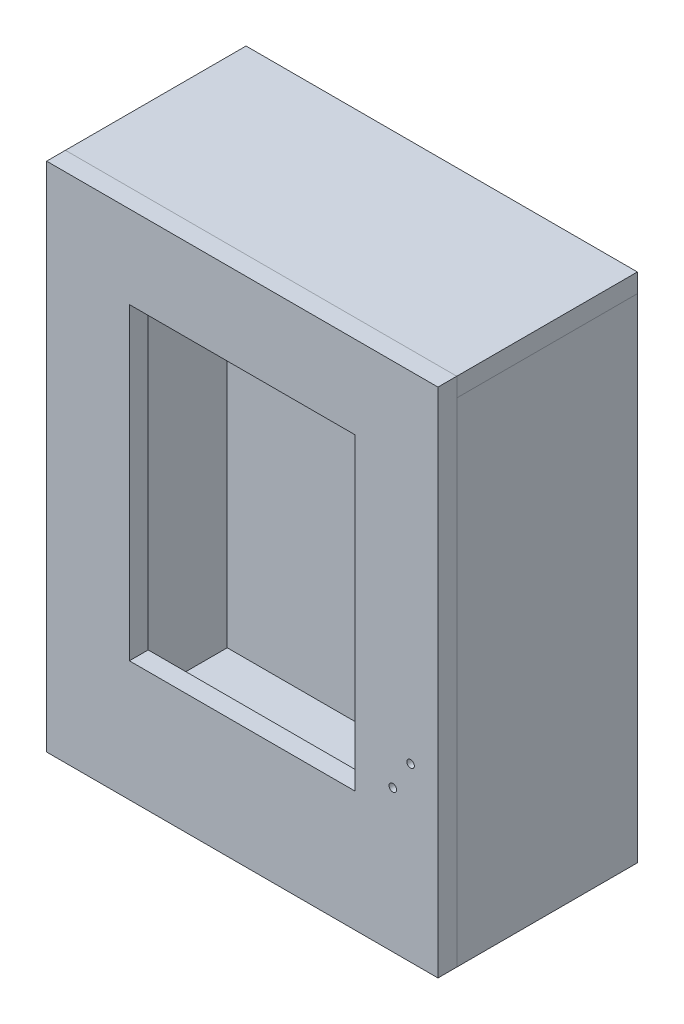
from build123d import *

# Parameters (mm, degrees)
SKETCH1_W           = 330.2
SKETCH1_H           = 431.8
SKETCH1_R           = 3.175
SKETCH1_W_2         = 190.5
SKETCH1_H_2         = 260.35
BOSS_EXTRUDE1_DEPTH = 7.9375
SKETCH3_W           = 152.4
SKETCH3_H           = 415.925
BOSS_EXTRUDE2_DEPTH = 15.875
BOSS_EXTRUDE6_START = -15.875
SKETCH8_W           = 298.45
SKETCH8_H           = 415.925
SKETCH8_R           = 9.6012
BOSS_EXTRUDE6_DEPTH = 15.875
SKETCH11_W          = 298.45
SKETCH11_H          = 120.65
BOSS_EXTRUDE7_DEPTH = 15.875
SKETCH14_W          = 330.2
SKETCH14_H          = 152.4
BOSS_EXTRUDE8_DEPTH = 15.875
BOSS_EXTRUDE5_DEPTH = 139.7


with BuildPart() as part:
    # Sketch1 → Boss-Extrude1 (new, symmetric)
    with BuildSketch(Plane.XY):
        with Locations((0, -15.875)):
            Rectangle(SKETCH1_W, SKETCH1_H)
        with Locations((127, -111.775)):
            Circle(SKETCH1_R, mode=Mode.SUBTRACT)
        with Locations((142, -86.775)):
            Circle(SKETCH1_R, mode=Mode.SUBTRACT)
        Rectangle(SKETCH1_W_2, SKETCH1_H_2, mode=Mode.SUBTRACT)
    extrude(amount=BOSS_EXTRUDE1_DEPTH, both=True)


with BuildPart() as body_2:
    # Sketch3 → Boss-Extrude2 (new body)
    with BuildSketch(Plane(origin=(165.1, 0, 0), x_dir=(0, 0, -1), z_dir=(1, 0, 0))):
        with Locations((84.1375, -23.8125)):
            Rectangle(SKETCH3_W, SKETCH3_H)
    extrude(amount=-BOSS_EXTRUDE2_DEPTH)


with BuildPart() as body_3:
    # Mirror1: mirrored copy
    add(body_2.part.mirror(Plane(origin=(0, 0, 0), x_dir=(0, 0, 1), z_dir=(1, 0, 0))))


with BuildPart() as body_4:
    # Sketch8 → Boss-Extrude6 (new body)
    with BuildSketch(Plane(origin=(0, 0, -160.3375), x_dir=(-1, 0, 0), z_dir=(0, 0, -1)).offset(BOSS_EXTRUDE6_START)):
        with Locations((0, -23.8125)):
            Rectangle(SKETCH8_W, SKETCH8_H)
        with Locations(Location((-130.175, -200.025, 0), (0, 0, 90))):
            Circle(SKETCH8_R, mode=Mode.SUBTRACT)
    extrude(amount=-BOSS_EXTRUDE6_DEPTH)


with BuildPart() as body_5:
    # Sketch11 → Boss-Extrude7 (new body)
    with BuildSketch(Plane.XZ.offset(231.775)):
        with Locations((0, -68.2625)):
            Rectangle(SKETCH11_W, SKETCH11_H)
    extrude(amount=-BOSS_EXTRUDE7_DEPTH)


with BuildPart() as body_6:
    # Sketch14 → Boss-Extrude8 (new body)
    with BuildSketch(Plane(origin=(0, 200.025, 0), x_dir=(1, 0, 0), z_dir=(0, 1, 0))):
        with Locations((0, 84.1375)):
            Rectangle(SKETCH14_W, SKETCH14_H)
    extrude(amount=-BOSS_EXTRUDE8_DEPTH)


with BuildPart() as body_7:
    # Sketch7 → Boss-Extrude5 (new, symmetric)
    with BuildSketch(Plane(origin=(0, 0, 0), x_dir=(0, 0, -1), z_dir=(1, 0, 0))):
        Polygon((144.4625, 95.25), (144.4625, 34.925), (160.3375, 19.05), (160.3375, 95.25), align=None)
    extrude(amount=BOSS_EXTRUDE5_DEPTH, both=True)


solid = Compound([part.part, body_2.part, body_3.part, body_4.part, body_5.part, body_6.part, body_7.part])
